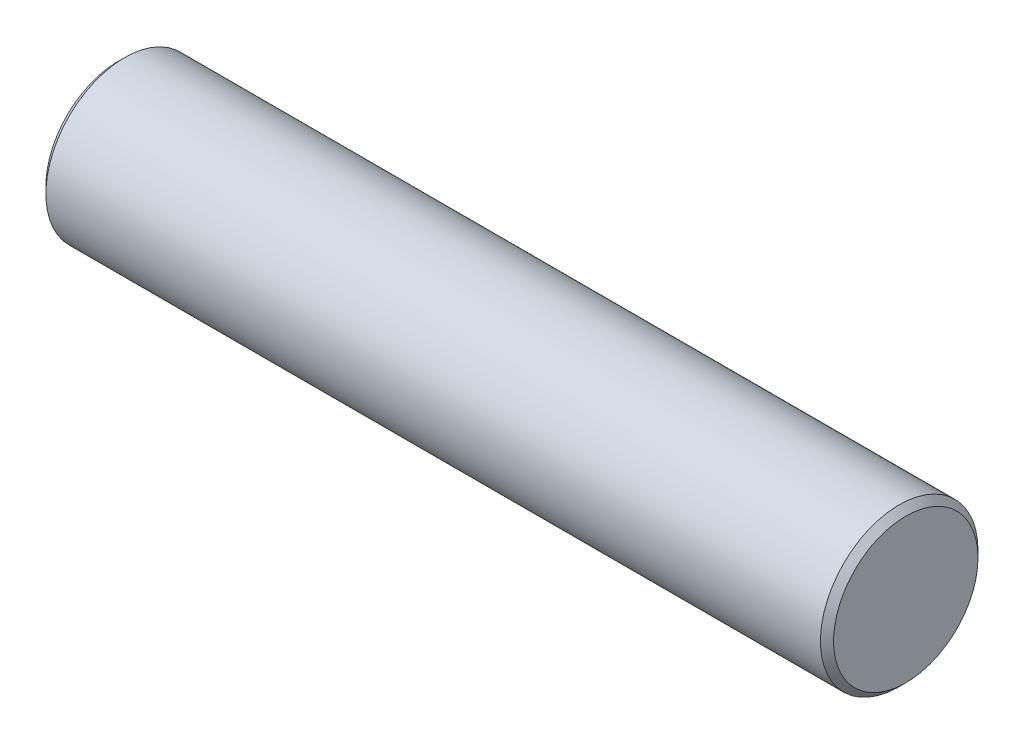
from build123d import *

# Parameters (mm, degrees)
SKETCH1_R           = 1.5
BOSS_EXTRUDE1_DEPTH = 7.5
CHAMFER1_SIZE       = 0.125


with BuildPart() as part:
    # Sketch1 → Boss-Extrude1 (new, symmetric)
    with BuildSketch(Plane(origin=(0, 0, 0), x_dir=(0, 0, -1), z_dir=(1, 0, 0))):
        Circle(SKETCH1_R)
    extrude(amount=BOSS_EXTRUDE1_DEPTH, both=True)

    # Chamfer1
    chamfer1_edges = [part.edges().sort_by_distance(p)[0] for p in [
        (-7.5, 0, 1.5),
        (7.5, 0, 1.5),
    ]]
    chamfer(chamfer1_edges, length=CHAMFER1_SIZE)


solid = part.part
